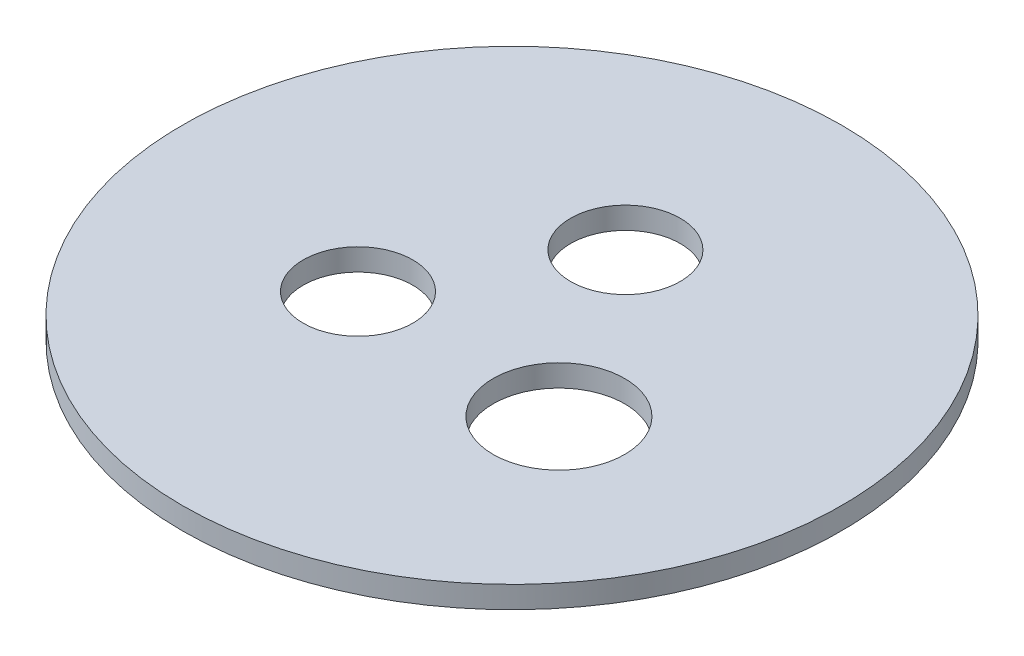
from build123d import *

# Parameters (mm, degrees)
SKETCH1_R           = 30.05
BOSS_EXTRUDE1_DEPTH = 2
SKETCH2_R           = 5
SKETCH2_R_2         = 6
CUT_EXTRUDE1_DEPTH  = 2


with BuildPart() as part:
    # Sketch1 → Boss-Extrude1 (new body)
    with BuildSketch(Plane(origin=(0, 0, 0), x_dir=(1, 0, 0), z_dir=(0, 1, 0))):
        with Locations(Location((0, 0, 0), (0, 0, 270))):
            Circle(SKETCH1_R)
    extrude(amount=BOSS_EXTRUDE1_DEPTH)

    # Sketch2 → Cut-Extrude1 (cut)
    with BuildSketch(Plane(origin=(0, 2, 0), x_dir=(1, 0, 0), z_dir=(0, 1, 0))):
        with Locations(Location((0, 10.34185389, 0), (0, 0, 270))):
            Circle(SKETCH2_R)
        with Locations(Location((-8.902654392, -5.139949909, 0), (0, 0, 270))):
            Circle(SKETCH2_R)
        with Locations(Location((10.1251211, -5.845741393, 0), (0, 0, 270))):
            Circle(SKETCH2_R_2)
    extrude(amount=-CUT_EXTRUDE1_DEPTH, mode=Mode.SUBTRACT)


solid = part.part
